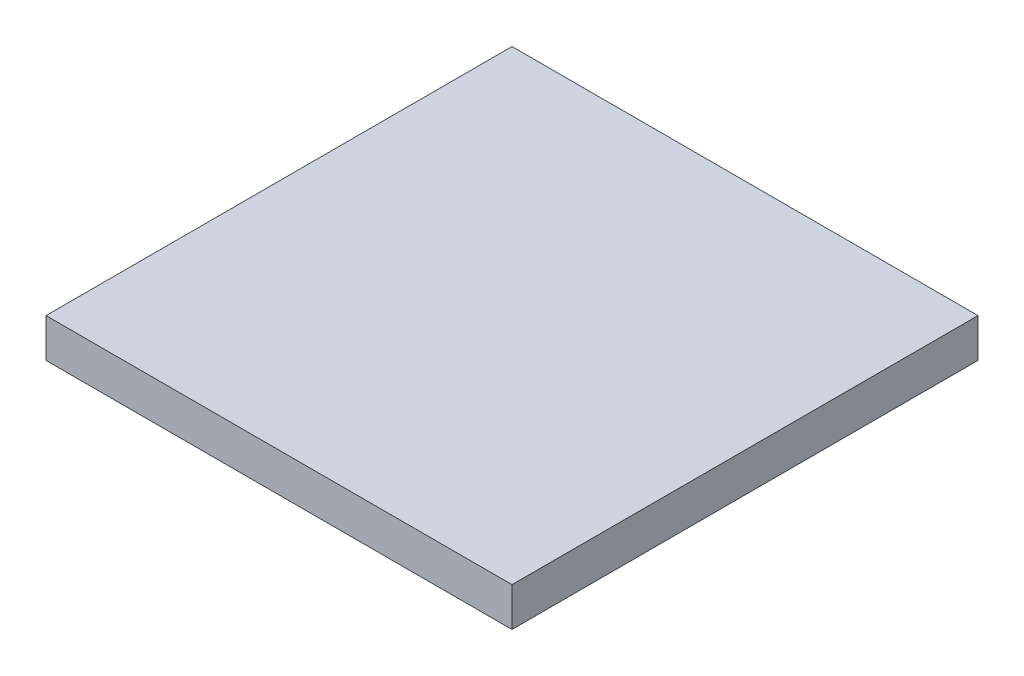
from build123d import *

# Parameters (mm, degrees)
SKETCH1_W           = 60
SKETCH1_H           = 60
BOSS_EXTRUDE1_DEPTH = 5


with BuildPart() as part:
    # Sketch1 → Boss-Extrude1 (new body)
    with BuildSketch(Plane(origin=(0, 0, 0), x_dir=(1, 0, 0), z_dir=(0, 1, 0))):
        Rectangle(SKETCH1_W, SKETCH1_H)
    extrude(amount=BOSS_EXTRUDE1_DEPTH)


solid = part.part
